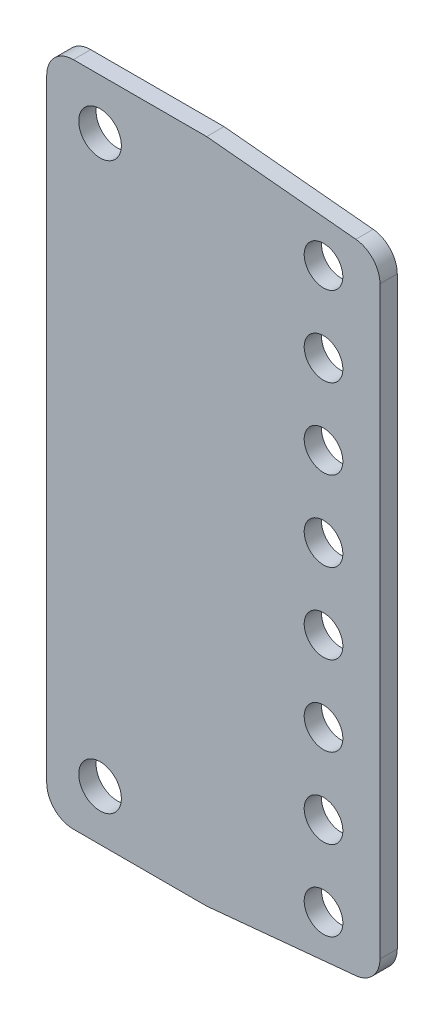
from build123d import *

# Parameters (mm, degrees)
SKETCH1_R           = 1.6
SKETCH1_R_2         = 1.45
BOSS_EXTRUDE1_DEPTH = 1.3
FILLET1_R           = 2


with BuildPart() as part:
    # Sketch1 → Boss-Extrude1 (new body)
    with BuildSketch(Plane.XY):
        Polygon((12, 50), (25, 48.75), (25, 1.25), (12, 0), (0, 0), (0, 50), align=None)
        with Locations((4, 46.213205)):
            Circle(SKETCH1_R, mode=Mode.SUBTRACT)
        with Locations((4, 3.786795)):
            Circle(SKETCH1_R, mode=Mode.SUBTRACT)
        with Locations((20.766795, 46)):
            Circle(SKETCH1_R_2, mode=Mode.SUBTRACT)
        with Locations((20.766795, 4)):
            Circle(SKETCH1_R_2, mode=Mode.SUBTRACT)
        with Locations((20.766795, 40)):
            Circle(SKETCH1_R_2, mode=Mode.SUBTRACT)
        with Locations((20.766795, 34)):
            Circle(SKETCH1_R_2, mode=Mode.SUBTRACT)
        with Locations((20.766795, 28)):
            Circle(SKETCH1_R_2, mode=Mode.SUBTRACT)
        with Locations((20.766795, 22)):
            Circle(SKETCH1_R_2, mode=Mode.SUBTRACT)
        with Locations((20.766795, 16)):
            Circle(SKETCH1_R_2, mode=Mode.SUBTRACT)
        with Locations((20.766795, 10)):
            Circle(SKETCH1_R_2, mode=Mode.SUBTRACT)
    extrude(amount=BOSS_EXTRUDE1_DEPTH)

    # Fillet1
    fillet1_edges = [part.edges().sort_by_distance(p)[0] for p in [
        (0, 50, 0.65),
        (25, 48.75, 0.65),
        (25, 1.25, 0.65),
        (0, 0, 0.65),
    ]]
    fillet(fillet1_edges, radius=FILLET1_R)


solid = part.part
